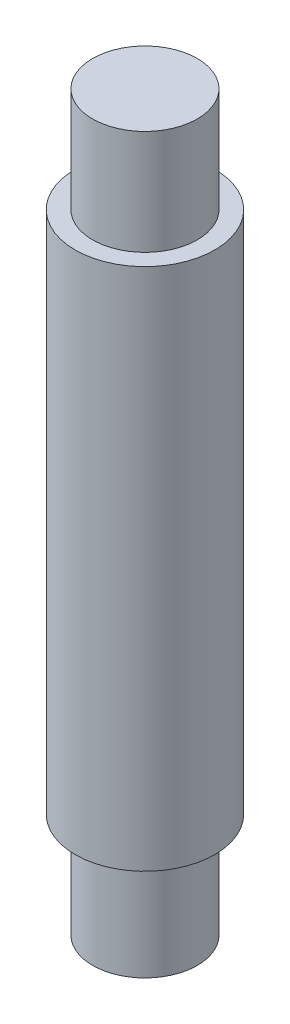
from build123d import *

# Parameters (mm, degrees)
SKETCH1_R           = 76.2
BOSS_EXTRUDE1_DEPTH = 152.4
SKETCH2_R           = 101.6
BOSS_EXTRUDE2_DEPTH = 762
SKETCH3_R           = 76.2
BOSS_EXTRUDE3_DEPTH = 152.4


with BuildPart() as part:
    # Sketch1 → Boss-Extrude1 (new body)
    with BuildSketch(Plane(origin=(0, 0, 0), x_dir=(1, 0, 0), z_dir=(0, 1, 0))):
        with Locations(Location((0, 0, 0), (0, 0, 90))):
            Circle(SKETCH1_R)
    extrude(amount=BOSS_EXTRUDE1_DEPTH)

    # Sketch2 → Boss-Extrude2 (add)
    with BuildSketch(Plane(origin=(0, 152.4, 0), x_dir=(1, 0, 0), z_dir=(0, 1, 0))):
        with Locations(Location((0, 0, 0), (0, 0, 270))):
            Circle(SKETCH2_R)
    extrude(amount=BOSS_EXTRUDE2_DEPTH)

    # Sketch3 → Boss-Extrude3 (add)
    with BuildSketch(Plane(origin=(0, 914.4, 0), x_dir=(1, 0, 0), z_dir=(0, 1, 0))):
        with Locations(Location((0, 0, 0), (0, 0, 90))):
            Circle(SKETCH3_R)
    extrude(amount=BOSS_EXTRUDE3_DEPTH)


solid = part.part
